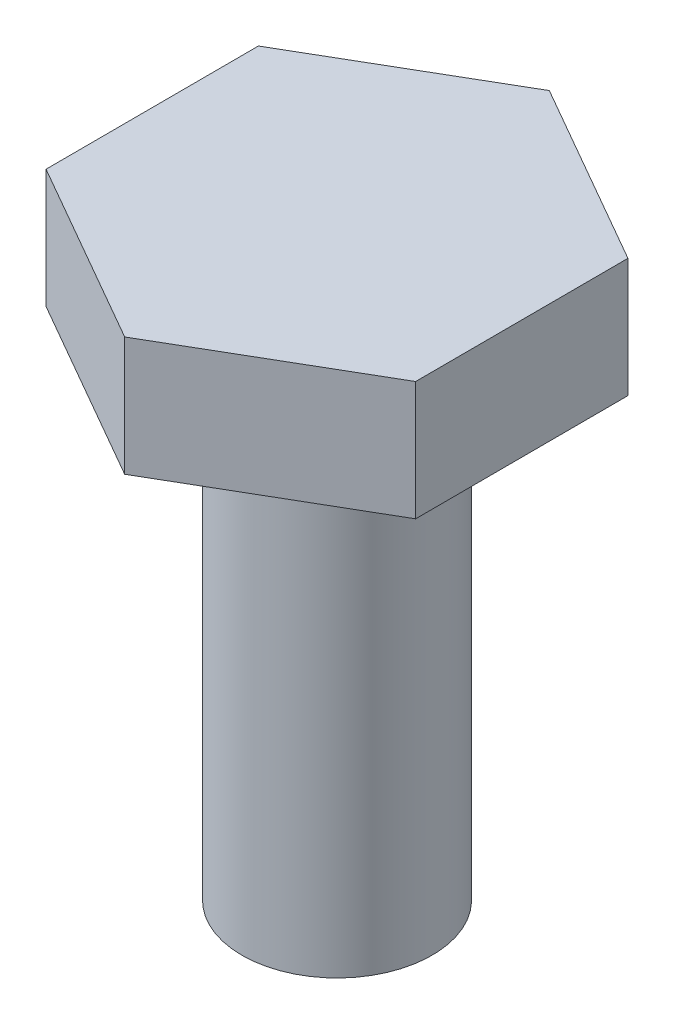
from build123d import *

# Parameters (mm, degrees)
SKETCH_1_R      = 0.8
EXTRUDE_1_DEPTH = 4
EXTRUDE_2_DEPTH = 1


with BuildPart() as part:
    # 草图1 → 凸台-拉伸1 (new body)
    with BuildSketch(Plane(origin=(0, 0, 0), x_dir=(1, 0, 0), z_dir=(0, 1, 0))):
        with Locations(Location((0, 0, 0), (0, 0, 270))):
            Circle(SKETCH_1_R)
    extrude(amount=EXTRUDE_1_DEPTH)

    # 草图2 → 凸台-拉伸2 (add)
    with BuildSketch(Plane(origin=(0, 4, 0), x_dir=(1, 0, 0), z_dir=(0, 1, 0))):
        Polygon((1.552246952, -0.89098975), (1.547743234, 0.898790418), (-0.004503718, 1.789780168), (-1.552246952, 0.89098975), (-1.547743234, -0.898790418), (0.004503718, -1.789780168), align=None)
    extrude(amount=EXTRUDE_2_DEPTH)


solid = part.part
